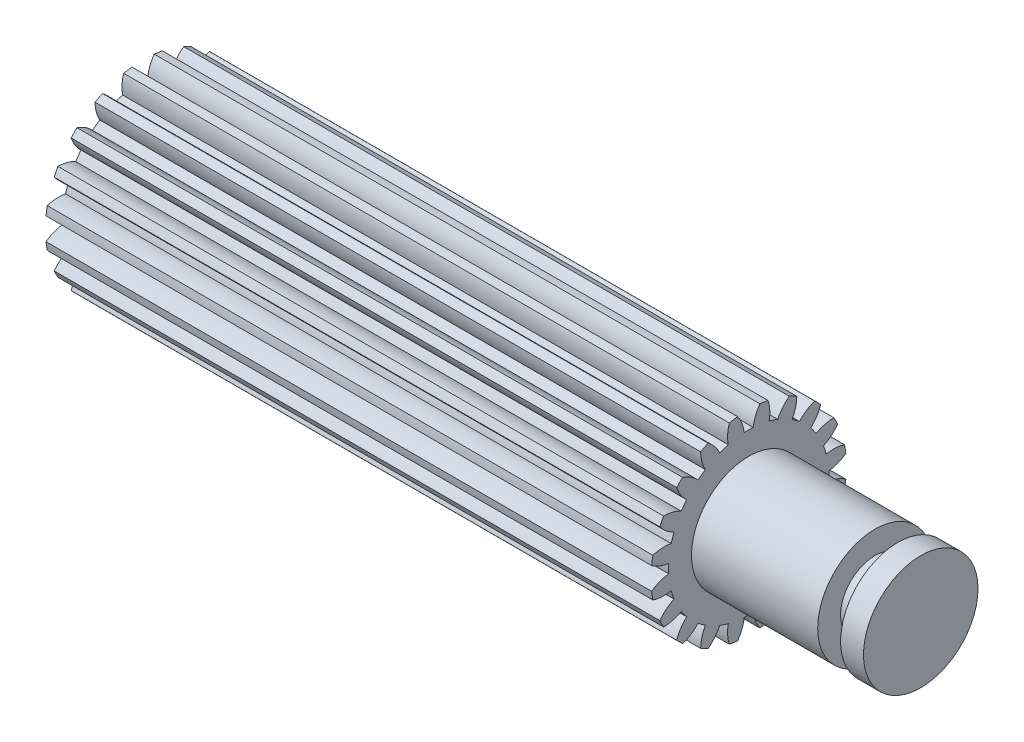
from build123d import *

# Parameters (mm, degrees)
BASPROSKE_W         = 132.2299391
BASPROSKE_H         = 22
TOOTHCUT_DEPTH      = 136.840924593
TEETHCUTS_COUNT     = 20
TEETHCUTS_ANGLE     = 342
BORSKE_R            = 0.4
BORE_DEPTH          = 50.0000508
SKETCH1_R           = 22
SKETCH1_R_2         = 21.342673338
CUT_EXTRUDE1_DEPTH  = 136.778456297
SCALE1_SCALE        = 0.4
SKETCH6_R           = 5
BOSS_EXTRUDE3_DEPTH = 15.0233807
CUT_EXTRUDE2_DEPTH  = 10
CUT_EXTRUDE3_START  = -2
SKETCH8_R           = 5
SKETCH8_R_2         = 3
CUT_EXTRUDE3_DEPTH  = 2


with BuildPart() as part:
    # BasProSke → Base-Revolve (revolve)
    with BuildSketch(Plane(origin=(0, 0, 0), x_dir=(1, 0, 0), z_dir=(0, 1, 0)), mode=Mode.PRIVATE) as base_revolve_sk:
        with Locations((66.11496955, 11)):
            Rectangle(BASPROSKE_W, BASPROSKE_H)
    revolve(base_revolve_sk.sketch.rotate(Axis((-10, 0, 0), (1, 0, 0)), 180), axis=Axis((-10, 0, 0), (1, 0, 0)))

    # TooCutSke → ToothCut (cut, through all)
    with BuildSketch(Plane(origin=(0, 0, 0), x_dir=(0, 0, -1), z_dir=(1, 0, 0))):
        with BuildLine():
            ThreePointArc((0.986171591, 17.471189616), (0, 17.499), (-0.986171591, 17.471189616))
            ThreePointArc((-0.986171591, 17.471189616), (-1.626916196, 19.798789858), (-2.932850173, 21.829260982))
            ThreePointArc((-2.932850173, 21.829260982), (0, 22.0254), (2.932850173, 21.829260982))
            ThreePointArc((2.932850173, 21.829260982), (1.626916196, 19.798789858), (0.986171591, 17.471189616))
        make_face()
    toothcut = extrude(amount=TOOTHCUT_DEPTH, mode=Mode.SUBTRACT)

    # TeethCuts: ToothCut ×20 about axis
    teethcuts_axis = Axis((-10, 0, 0), (1, 0, 0))
    for i in range(1, TEETHCUTS_COUNT):
        add(toothcut.rotate(teethcuts_axis, i * TEETHCUTS_ANGLE / (TEETHCUTS_COUNT - 1)), mode=Mode.SUBTRACT)

    # BorSke → Bore (cut, symmetric)
    with BuildSketch(Plane(origin=(0, 0, 0), x_dir=(0, 0, -1), z_dir=(1, 0, 0))):
        Circle(BORSKE_R)
    extrude(amount=BORE_DEPTH, both=True, mode=Mode.SUBTRACT)

    # Sketch1 → Cut-Extrude1 (cut, through all)
    with BuildSketch(Plane(origin=(132.2299391, 0, 0), x_dir=(0, 0, -1), z_dir=(1, 0, 0))):
        Circle(SKETCH1_R)
        Circle(SKETCH1_R_2, mode=Mode.SUBTRACT)
    extrude(amount=-CUT_EXTRUDE1_DEPTH, mode=Mode.SUBTRACT)


with BuildPart() as part_1:
    # Scale1: scaled about (0, 0, 0)
    add(part.part.scale(SCALE1_SCALE))

    # Sketch6 → Boss-Extrude3 (add)
    with BuildSketch(Plane(origin=(52.89197564, 0, 0), x_dir=(0, 0, -1), z_dir=(1, 0, 0))):
        with Locations(Location((0, 0, 0), (0, 0, 180))):
            Circle(SKETCH6_R)
    extrude(amount=BOSS_EXTRUDE3_DEPTH)

    # Sketch7 → Cut-Extrude2 (cut)
    with BuildSketch(Plane.ZY):
        with BuildLine():
            Line((2.5, 0), (2.5, 4.330127019))
            ThreePointArc((2.5, 4.330127019), (-5, 0), (2.5, -4.330127019))
            Line((2.5, -4.330127019), (2.5, 0))
        make_face()
    extrude(amount=-CUT_EXTRUDE2_DEPTH, mode=Mode.SUBTRACT)

    # Sketch8 → Cut-Extrude3 (cut)
    with BuildSketch(Plane(origin=(65.91535634, 0, 0), x_dir=(0, 0, -1), z_dir=(1, 0, 0)).offset(CUT_EXTRUDE3_START)):
        with Locations(Location((0, 0, 0), (0, 0, 180))):
            Circle(SKETCH8_R)
        Circle(SKETCH8_R_2, mode=Mode.SUBTRACT)
    extrude(amount=CUT_EXTRUDE3_DEPTH, mode=Mode.SUBTRACT)


solid = part_1.part
